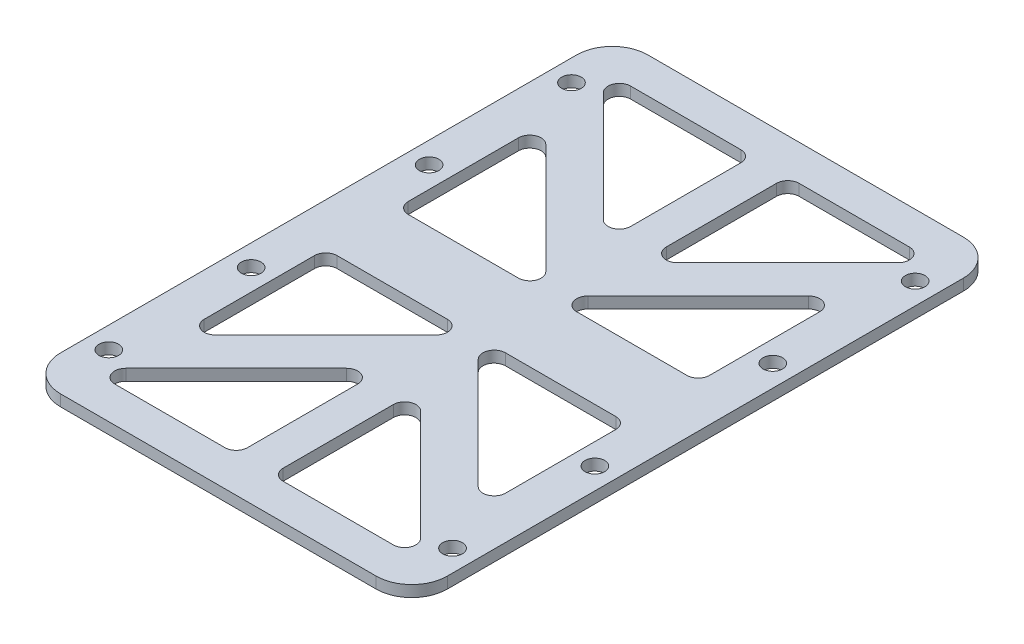
from build123d import *

# Parameters (mm, degrees)
BOSS_EXTRUDE1_DEPTH  = 3.175
M5_CLEARANCE_HOLE1_D = 5.5
CUT_EXTRUDE1_DEPTH   = 99.833045415


with BuildPart() as part:
    # Sketch1 → Boss-Extrude1 (new body)
    with BuildSketch(Plane(origin=(0, 0, 0), x_dir=(1, 0, 0), z_dir=(0, 1, 0))):
        with BuildLine():
            Line((-44.329, -82.5), (44.329, -82.5))
            ThreePointArc((44.329, -82.5), (51.400067812, -79.571067812), (54.329, -72.5))
            Line((54.329, -72.5), (54.329, 72.5))
            ThreePointArc((54.329, 72.5), (51.400067812, 79.571067812), (44.329, 82.5))
            Line((44.329, 82.5), (-44.329, 82.5))
            ThreePointArc((-44.329, 82.5), (-51.400067812, 79.571067812), (-54.329, 72.5))
            Line((-54.329, 72.5), (-54.329, -72.5))
            ThreePointArc((-54.329, -72.5), (-51.400067812, -79.571067812), (-44.329, -82.5))
        make_face()
    extrude(amount=BOSS_EXTRUDE1_DEPTH)

    # M5 Clearance Hole1 (through all)
    with Locations(Plane(origin=(0, 3.175, 0), x_dir=(1, 0, 0), z_dir=(0, 1, 0))):
        with Locations((-48.29, 65), (-48.29, -65), (48.29, -65), (48.29, 65), (-48.29, 25), (-48.29, -25), (48.29, 25), (48.29, -25)):
            Hole(M5_CLEARANCE_HOLE1_D / 2)

    # Sketch4 → Cut-Extrude1 (cut, through all)
    with BuildSketch(Plane(origin=(0, 3.175, 0), x_dir=(1, 0, 0), z_dir=(0, 1, 0))):
        with BuildLine():
            Line((-42.329, 44.154), (-42.329, 13.175))
            ThreePointArc((-42.329, 13.175), (-41.39906403, 10.92993597), (-39.154, 10))
            Line((-39.154, 10), (-8.175, 10))
            ThreePointArc((-8.175, 10), (-5.241682484, 11.959980102), (-5.92993597, 15.42006403))
            Line((-5.92993597, 15.42006403), (-36.90893597, 46.39906403))
            ThreePointArc((-36.90893597, 46.39906403), (-40.369019898, 47.087317516), (-42.329, 44.154))
        make_face()
        with BuildLine():
            Line((39.154, 72.5), (8.175, 72.5))
            ThreePointArc((8.175, 72.5), (5.92993597, 71.57006403), (5, 69.325))
            Line((5, 69.325), (5, 38.346))
            ThreePointArc((5, 38.346), (6.959980102, 35.412682484), (10.42006403, 36.10093597))
            Line((10.42006403, 36.10093597), (41.39906403, 67.07993597))
            ThreePointArc((41.39906403, 67.07993597), (42.087317516, 70.540019898), (39.154, 72.5))
        make_face()
        with BuildLine():
            Line((-5, 69.325), (-5, 38.346))
            ThreePointArc((-5, 38.346), (-6.959980102, 35.412682484), (-10.42006403, 36.10093597))
            Line((-10.42006403, 36.10093597), (-41.39906403, 67.07993597))
            ThreePointArc((-41.39906403, 67.07993597), (-42.087317516, 70.540019898), (-39.154, 72.5))
            Line((-39.154, 72.5), (-8.175, 72.5))
            ThreePointArc((-8.175, 72.5), (-5.92993597, 71.57006403), (-5, 69.325))
        make_face()
        with BuildLine():
            Line((5.92993597, 15.42006403), (36.90893597, 46.39906403))
            ThreePointArc((36.90893597, 46.39906403), (40.369019898, 47.087317516), (42.329, 44.154))
            Line((42.329, 44.154), (42.329, 13.175))
            ThreePointArc((42.329, 13.175), (41.39906403, 10.92993597), (39.154, 10))
            Line((39.154, 10), (8.175, 10))
            ThreePointArc((8.175, 10), (5.241682484, 11.959980102), (5.92993597, 15.42006403))
        make_face()
        with BuildLine():
            Line((42.329, -44.154), (42.329, -13.175))
            ThreePointArc((42.329, -13.175), (41.39906403, -10.92993597), (39.154, -10))
            Line((39.154, -10), (8.175, -10))
            ThreePointArc((8.175, -10), (5.241682484, -11.959980102), (5.92993597, -15.42006403))
            Line((5.92993597, -15.42006403), (36.90893597, -46.39906403))
            ThreePointArc((36.90893597, -46.39906403), (40.369019898, -47.087317516), (42.329, -44.154))
        make_face()
        with BuildLine():
            Line((5, -69.325), (5, -38.346))
            ThreePointArc((5, -38.346), (6.959980102, -35.412682484), (10.42006403, -36.10093597))
            Line((10.42006403, -36.10093597), (41.39906403, -67.07993597))
            ThreePointArc((41.39906403, -67.07993597), (42.087317516, -70.540019898), (39.154, -72.5))
            Line((39.154, -72.5), (8.175, -72.5))
            ThreePointArc((8.175, -72.5), (5.92993597, -71.57006403), (5, -69.325))
        make_face()
        with BuildLine():
            Line((-39.154, -72.5), (-8.175, -72.5))
            ThreePointArc((-8.175, -72.5), (-5.92993597, -71.57006403), (-5, -69.325))
            Line((-5, -69.325), (-5, -38.346))
            ThreePointArc((-5, -38.346), (-6.959980102, -35.412682484), (-10.42006403, -36.10093597))
            Line((-10.42006403, -36.10093597), (-41.39906403, -67.07993597))
            ThreePointArc((-41.39906403, -67.07993597), (-42.087317516, -70.540019898), (-39.154, -72.5))
        make_face()
        with BuildLine():
            Line((-5.92993597, -15.42006403), (-36.90893597, -46.39906403))
            ThreePointArc((-36.90893597, -46.39906403), (-40.369019898, -47.087317516), (-42.329, -44.154))
            Line((-42.329, -44.154), (-42.329, -13.175))
            ThreePointArc((-42.329, -13.175), (-41.39906403, -10.92993597), (-39.154, -10))
            Line((-39.154, -10), (-8.175, -10))
            ThreePointArc((-8.175, -10), (-5.241682484, -11.959980102), (-5.92993597, -15.42006403))
        make_face()
    extrude(amount=-CUT_EXTRUDE1_DEPTH, mode=Mode.SUBTRACT)


solid = part.part
